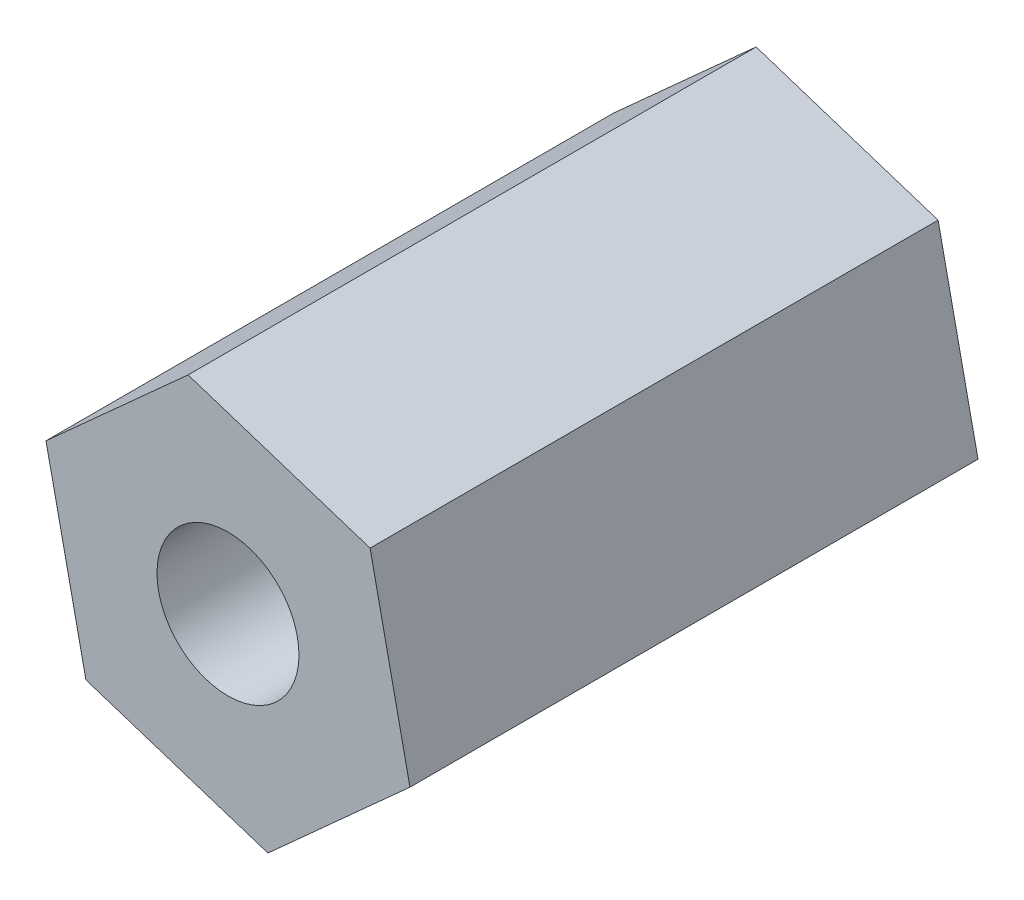
from build123d import *

# Parameters (mm, degrees)
RESSALTO_EXTRUS_O1_DEPTH = 12
CORTE_EXTRUS_O2_REACH    = 15.206
ESBO_O3_R                = 1.5


with BuildPart() as part:
    # Esboço1 → Ressalto-extrusão1 (new body)
    with BuildSketch(Plane.XY):
        Polygon((-0.842772028, 3.952602768), (-3.844440422, 1.246439398), (-3.001668394, -2.70616337), (0.842772028, -3.952602768), (3.844440422, -1.246439398), (3.001668394, 2.70616337), align=None)
    extrude(amount=RESSALTO_EXTRUS_O1_DEPTH)

    # Esboço3 → Corte-extrusão2 (cut, up to next)
    with BuildSketch(Plane(origin=(0, 0, 0), x_dir=(-1, 0, 0), z_dir=(0, 0, -1)), mode=Mode.PRIVATE) as corte_extrus_o2_sk1:
        Circle(ESBO_O3_R)
    corte_extrus_o2_tool1 = extrude(corte_extrus_o2_sk1.sketch, amount=-CORTE_EXTRUS_O2_REACH, mode=Mode.PRIVATE) & part.part
    add(corte_extrus_o2_tool1.solids().sort_by_distance((0, 0, 0))[0], mode=Mode.SUBTRACT)


solid = part.part
